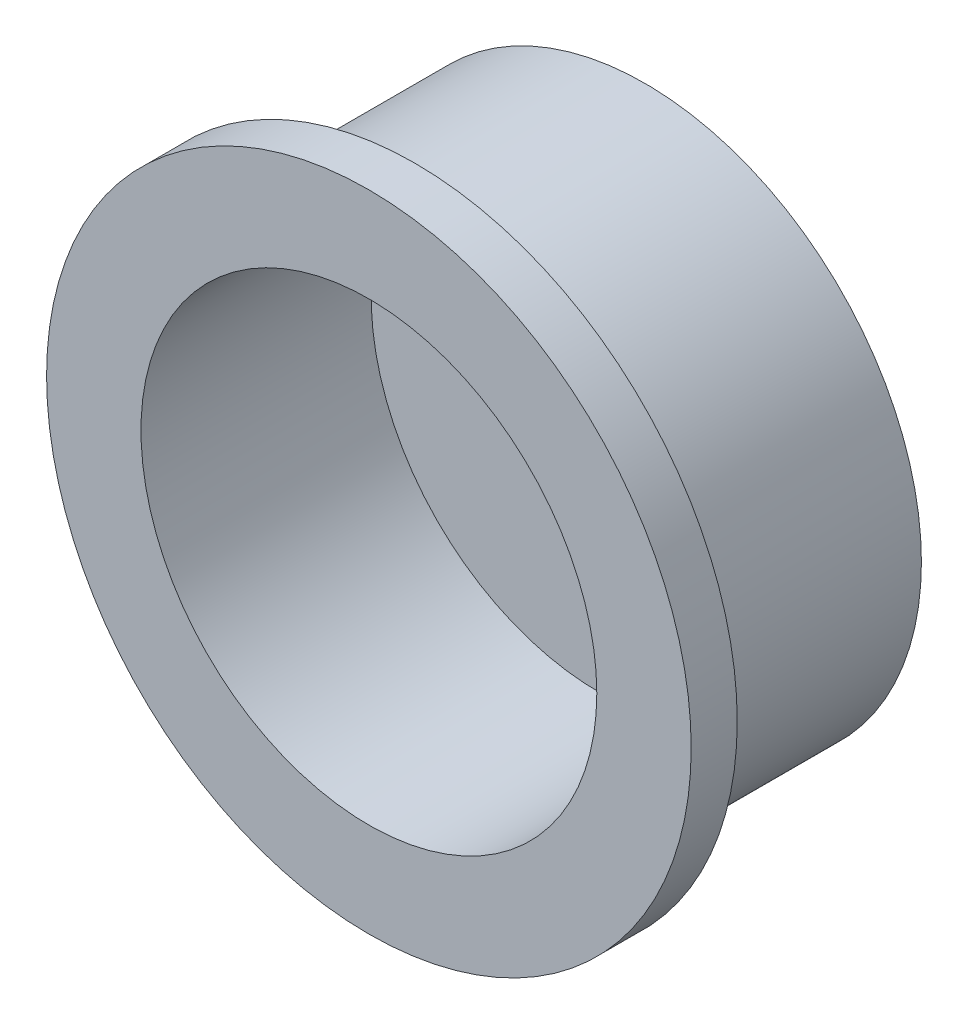
from build123d import *

# Parameters (mm, degrees)
SKETCH_1_R          = 6
EXTRUDE_1_DEPTH     = 1
SKETCH_2_R          = 6
SKETCH_2_R_2        = 4.95
EXTRUDE_2_DEPTH     = 5
SKETCH_3_R          = 7
EXTRUDE_3_DEPTH     = 1
CUT_EXTRUDE_START   = -5
SKETCH_5_R          = 4.95
CUT_EXTRUDE_1_DEPTH = 5
SKETCH_6_R          = 1.5
CUT_EXTRUDE_2_DEPTH = 1


with BuildPart() as part:
    # Эскиз1 → Бобышка-Вытянуть1 (new body)
    with BuildSketch(Plane.XY):
        Circle(SKETCH_1_R)
    extrude(amount=EXTRUDE_1_DEPTH)

    # Эскиз2 → Бобышка-Вытянуть2 (add)
    with BuildSketch(Plane.XY.offset(1)):
        Circle(SKETCH_2_R)
        Circle(SKETCH_2_R_2, mode=Mode.SUBTRACT)
    extrude(amount=EXTRUDE_2_DEPTH)

    # Эскиз3 → Бобышка-Вытянуть3 (add)
    with BuildSketch(Plane.XY.offset(6)):
        Circle(SKETCH_3_R)
    extrude(amount=-EXTRUDE_3_DEPTH)

    # Эскиз5 → Вырез-Вытянуть1 (cut)
    with BuildSketch(Plane.XY.offset(6).offset(CUT_EXTRUDE_START)):
        Circle(SKETCH_5_R)
    extrude(amount=CUT_EXTRUDE_1_DEPTH, mode=Mode.SUBTRACT)

    # Эскиз6 → Вырез-Вытянуть2 (cut)
    with BuildSketch(Plane.XY.offset(1)):
        Circle(SKETCH_6_R)
    extrude(amount=-CUT_EXTRUDE_2_DEPTH, mode=Mode.SUBTRACT)


solid = part.part
